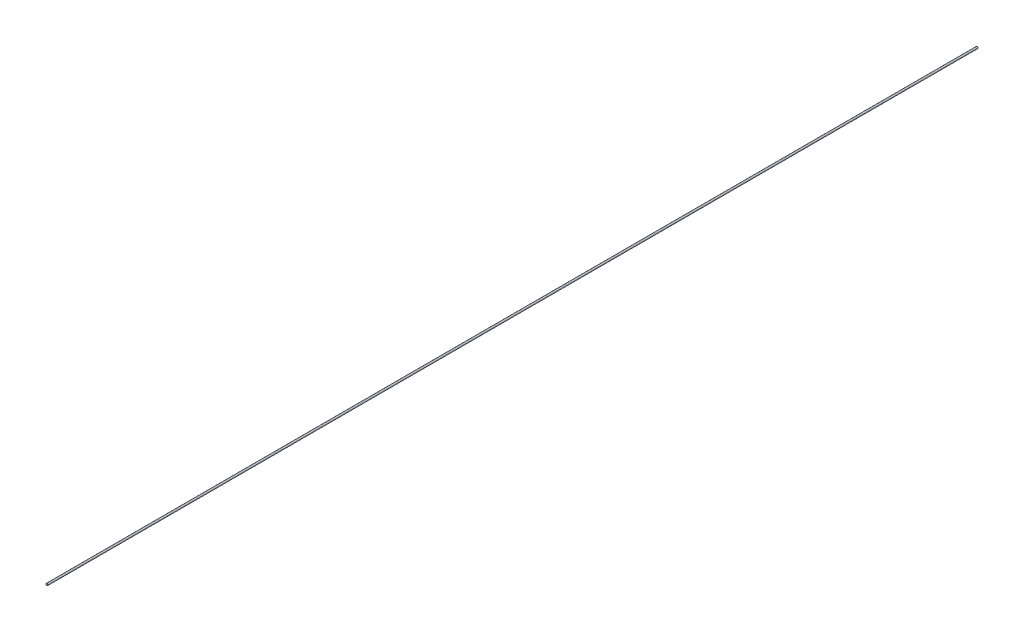
from build123d import *

# Parameters (mm, degrees)
SKETCH1_R           = 0.04
BOSS_EXTRUDE1_DEPTH = 40


with BuildPart() as part:
    # Sketch1 → Boss-Extrude1 (new body)
    with BuildSketch(Plane.XY):
        Circle(SKETCH1_R)
    extrude(amount=BOSS_EXTRUDE1_DEPTH)


solid = part.part
